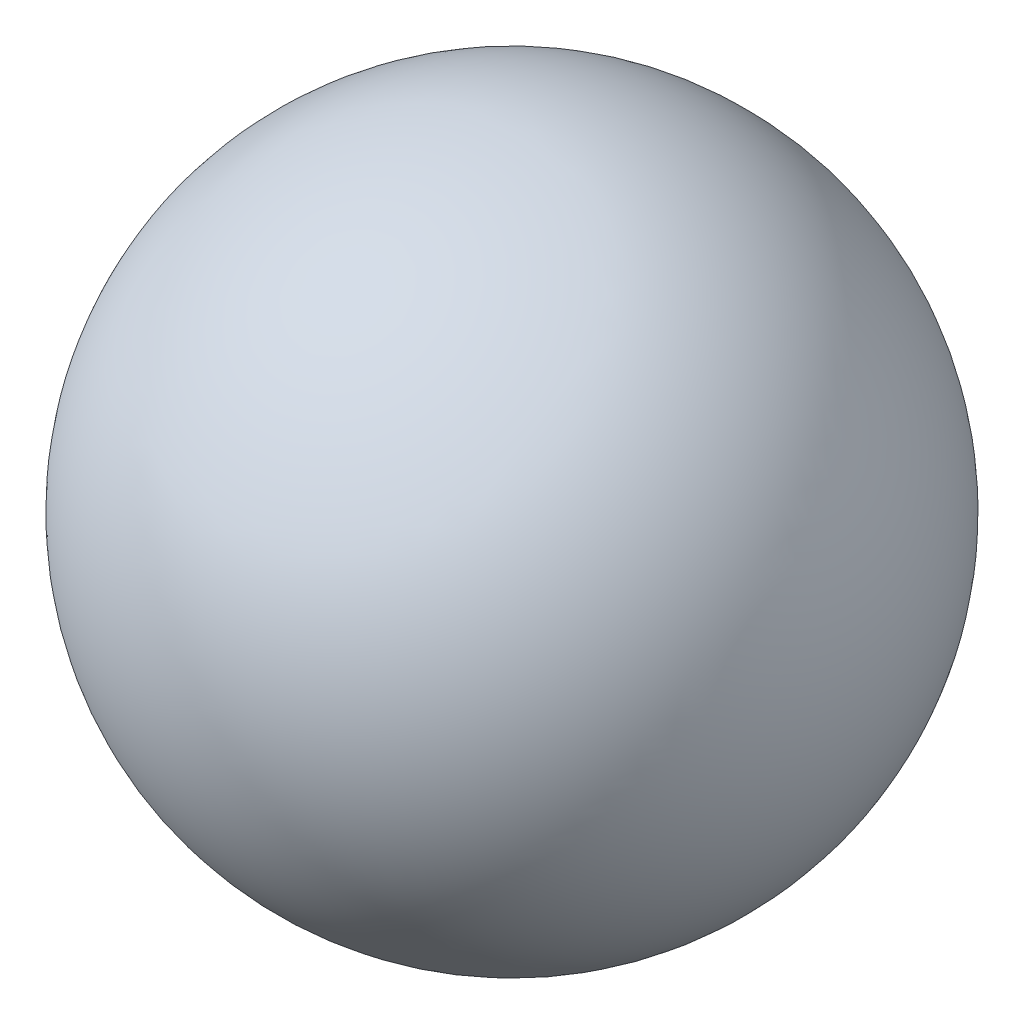
from build123d import *


with BuildPart() as part:
    # 草图1 → 旋转1 (revolve)
    with BuildSketch(Plane.XY):
        with BuildLine():
            Line((0, 0), (-240, 0))
            ThreePointArc((-240, 0), (-120, 120), (0, 0))
        make_face()
    revolve(axis=Axis((-240, 0, 0), (1, 0, 0)))


solid = part.part
